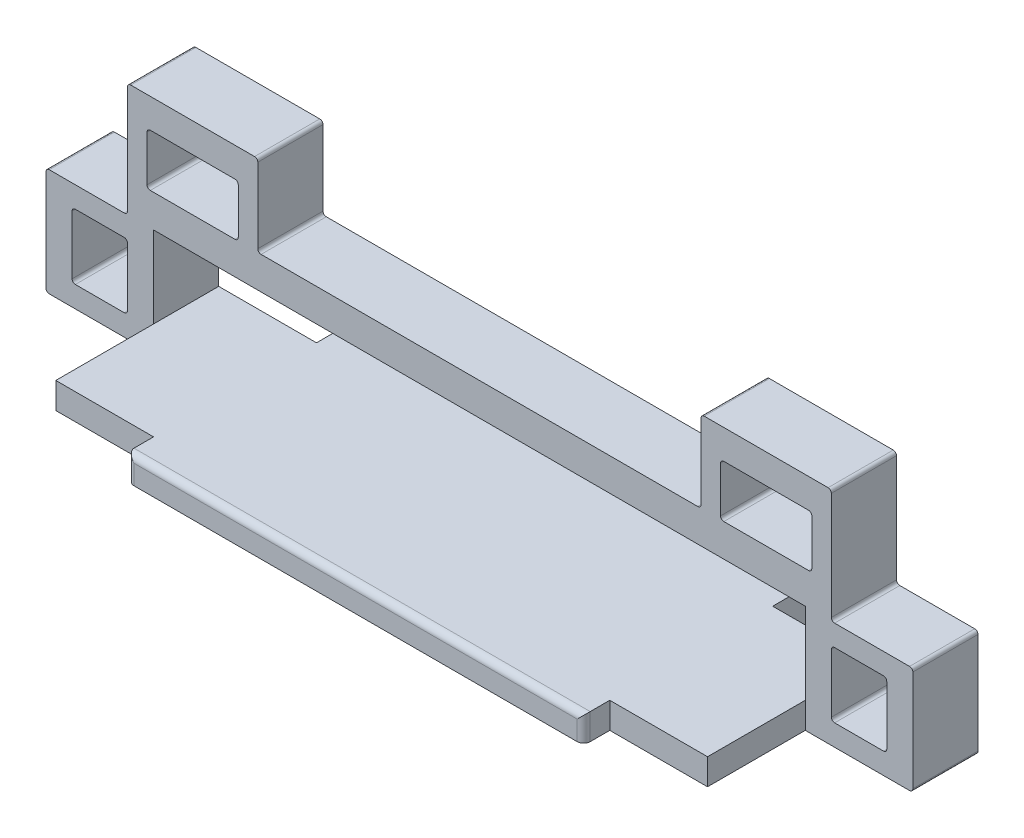
from build123d import *

# Parameters (mm, degrees)
SKETCH_2_W               = 200
SKETCH_2_H               = 50
EXTRUDE_1_DEPTH          = 8
SKETCH_5_W               = 8
SKETCH_5_H               = 20
EXTRUDE_6_DEPTH          = 33
SKETCH_7_W               = 216
SKETCH_7_H               = 20
EXTRUDE_7_DEPTH          = 10
SKETCH_8_W               = 140
SKETCH_8_H               = 8
EXTRUDE_8_DEPTH          = 8
SKETCH_9_W               = 140
SKETCH_9_H               = 10
EXTRUDE_9_DEPTH          = 24
SKETCH_10_W              = 20
SKETCH_10_H              = 8
EXTRUDE_10_DEPTH         = 30
FILLET_1_R               = 2
SKETCH_11_W              = 40
SKETCH_11_H              = 20
EXTRUDE_11_DEPTH         = 25
CUT_EXTRUDE_1_DEPTH      = 148.676305673
CUT_EXTRUDE_1_DEPTH_BACK = 148.676305673
SKETCH_12_W              = 28
SKETCH_12_H              = 16
SKETCH_13_W              = 20
SKETCH_13_H              = 33
EXTRUDE_12_DEPTH         = 25
SKETCH_14_W              = 20
SKETCH_14_H              = 33
EXTRUDE_13_DEPTH         = 25
CUT_EXTRUDE_2_DEPTH      = 170.429357345
CUT_EXTRUDE_2_DEPTH_BACK = 170.429357345
SKETCH_15_W              = 17
SKETCH_15_H              = 20
FILLET_2_R               = 1


with BuildPart() as part:
    # 스케치2 → 보스-돌출1 (new body)
    with BuildSketch(Plane(origin=(0, 0, 0), x_dir=(1, 0, 0), z_dir=(0, 1, 0))):
        with Locations((-17.46031746, 73.968253968)):
            Rectangle(SKETCH_2_W, SKETCH_2_H)
    extrude(amount=EXTRUDE_1_DEPTH)

    # 스케치5 → 보스-돌출6 (add)
    with BuildSketch(Plane.XZ.offset(-33)):
        with Locations((-121.46031746, -88.968253968)):
            Rectangle(SKETCH_5_W, SKETCH_5_H)
        with Locations((86.53968254, -88.968253968)):
            Rectangle(SKETCH_5_W, SKETCH_5_H)
    extrude(amount=EXTRUDE_6_DEPTH)

    # 스케치7 → 보스-돌출7 (add)
    with BuildSketch(Plane(origin=(0, 33, 0), x_dir=(1, 0, 0), z_dir=(0, 1, 0))):
        with Locations((-17.46031746, 88.968253968)):
            Rectangle(SKETCH_7_W, SKETCH_7_H)
    extrude(amount=EXTRUDE_7_DEPTH)

    # 스케치8 → 보스-돌출8 (add)
    with BuildSketch(Plane(origin=(0, 8, 0), x_dir=(1, 0, 0), z_dir=(0, 1, 0))):
        with Locations((-17.46031746, 44.968253968)):
            Rectangle(SKETCH_8_W, SKETCH_8_H)
    extrude(amount=-EXTRUDE_8_DEPTH)

    # 스케치9 → 보스-돌출9 (add)
    with BuildSketch(Plane(origin=(0, 8, 0), x_dir=(1, 0, 0), z_dir=(0, 1, 0))):
        with Locations((-17.46031746, 103.968253968)):
            Rectangle(SKETCH_9_W, SKETCH_9_H)
    extrude(amount=-EXTRUDE_9_DEPTH)

    # 스케치10 → 보스-돌출10 (add)
    with BuildSketch(Plane.XY.offset(-98.968253968)):
        with Locations((-77.46031746, -12)):
            Rectangle(SKETCH_10_W, SKETCH_10_H)
        with Locations((42.53968254, -12)):
            Rectangle(SKETCH_10_W, SKETCH_10_H)
    extrude(amount=EXTRUDE_10_DEPTH)

    # 필렛1
    fillet_1_edges = [part.edges().sort_by_distance(p)[0] for p in [
        (-87.46031746, 4, -40.968253968),
        (52.53968254, 4, -40.968253968),
        (-17.46031746, 8, -40.968253968),
    ]]
    fillet(fillet_1_edges, radius=FILLET_1_R)

    # 스케치11 → 보스-돌출11 (add)
    with BuildSketch(Plane(origin=(0, 43, 0), x_dir=(1, 0, 0), z_dir=(0, 1, 0))):
        with Locations((-105.46031746, 88.968253968)):
            Rectangle(SKETCH_11_W, SKETCH_11_H)
        with Locations((70.53968254, 88.968253968)):
            Rectangle(SKETCH_11_W, SKETCH_11_H)
    extrude(amount=EXTRUDE_11_DEPTH)

    # 스케치12 → 컷-돌출1 (cut, two sides: drawn at the far end of the back side and taken through both)
    with BuildSketch(Plane.XY.offset(-78.968253968).offset(-CUT_EXTRUDE_1_DEPTH_BACK)):
        with Locations((-105.46031746, 51)):
            Rectangle(SKETCH_12_W, SKETCH_12_H)
        with Locations((70.53968254, 51)):
            Rectangle(SKETCH_12_W, SKETCH_12_H)
    extrude(amount=CUT_EXTRUDE_1_DEPTH + CUT_EXTRUDE_1_DEPTH_BACK, mode=Mode.SUBTRACT)

    # 스케치13 → 보스-돌출12 (add)
    with BuildSketch(Plane(origin=(90.53968254, 0, 0), x_dir=(0, 0, -1), z_dir=(1, 0, 0))):
        with Locations((88.968253968, 16.5)):
            Rectangle(SKETCH_13_W, SKETCH_13_H)
    extrude(amount=EXTRUDE_12_DEPTH)

    # 스케치14 → 보스-돌출13 (add)
    with BuildSketch(Plane.ZY.offset(125.46031746)):
        with Locations((-88.968253968, 16.5)):
            Rectangle(SKETCH_14_W, SKETCH_14_H)
    extrude(amount=EXTRUDE_13_DEPTH)

    # 스케치15 → 컷-돌출2 (cut, two sides: drawn at the far end of the back side and taken through both)
    with BuildSketch(Plane.XY.offset(-78.968253968).offset(-CUT_EXTRUDE_2_DEPTH_BACK)):
        with Locations((-133.96031746, 16.5)):
            Rectangle(SKETCH_15_W, SKETCH_15_H)
        with Locations((99.03968254, 16.5)):
            Rectangle(SKETCH_15_W, SKETCH_15_H)
    extrude(amount=CUT_EXTRUDE_2_DEPTH + CUT_EXTRUDE_2_DEPTH_BACK, mode=Mode.SUBTRACT)

    # 필렛2
    fillet_2_edges = [part.edges().sort_by_distance(p)[0] for p in [
        (-85.46031746, 43, -88.968253968),
        (-125.46031746, 68, -88.968253968),
        (-85.46031746, 68, -88.968253968),
        (50.53968254, 43, -88.968253968),
        (50.53968254, 68, -88.968253968),
        (90.53968254, 68, -88.968253968),
        (-91.46031746, 59, -88.968253968),
        (-91.46031746, 43, -88.968253968),
        (-119.46031746, 43, -88.968253968),
        (-119.46031746, 59, -88.968253968),
        (84.53968254, 59, -88.968253968),
        (84.53968254, 43, -88.968253968),
        (56.53968254, 43, -88.968253968),
        (56.53968254, 59, -88.968253968),
        (90.53968254, 33, -88.968253968),
        (115.53968254, 0, -88.968253968),
        (115.53968254, 33, -88.968253968),
        (-125.46031746, 33, -88.968253968),
        (-150.46031746, 0, -88.968253968),
        (-150.46031746, 33, -88.968253968),
        (-142.46031746, 6.5, -88.968253968),
        (-142.46031746, 26.5, -88.968253968),
        (-125.46031746, 26.5, -88.968253968),
        (-125.46031746, 6.5, -88.968253968),
        (90.53968254, 6.5, -88.968253968),
        (90.53968254, 26.5, -88.968253968),
        (107.53968254, 26.5, -88.968253968),
        (107.53968254, 6.5, -88.968253968),
    ]]
    fillet(fillet_2_edges, radius=FILLET_2_R)


solid = part.part
